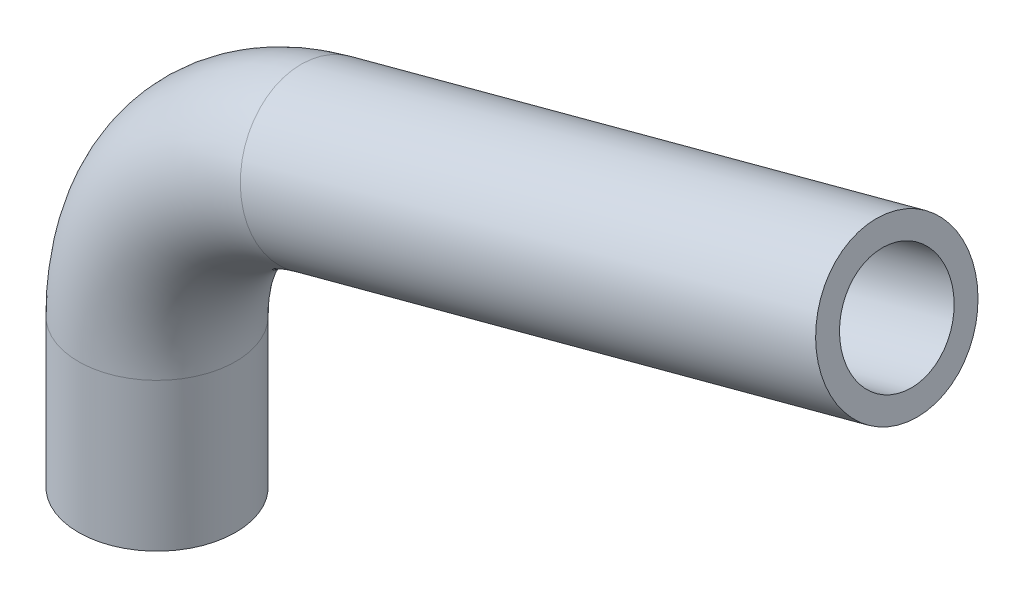
from build123d import *

# Parameters (mm, degrees)
SWEEP1_PROFILE_R     = 13.49375
CUT_SWEEP1_PROFILE_R = 9.525


with BuildPart() as part:
    # Sweep1: sweep along a curve in space
    with BuildLine() as sweep1_path:
        Line((0, 0, 0), (0, 25.4, 0))
        ThreePointArc((0, 25.4, 0), (7.873237735, 48.593810445, 0), (28.238994382, 62.201773982, 0))
        Line((28.238994382, 62.201773982, 0), (127, 88.664705681, 0))
    # Sweep1 profile (on start of the path) → Sweep1 (sweep)
    with BuildSketch(Plane.ZX):
        Circle(SWEEP1_PROFILE_R)
    sweep(path=sweep1_path.line)

    # Cut-Sweep1: sweep along a curve in space
    with BuildLine() as cut_sweep1_path:
        Line((0, 0, 0), (0, 25.4, 0))
        ThreePointArc((0, 25.4, 0), (7.873237735, 48.593810445, 0), (28.238994382, 62.201773982, 0))
        Line((28.238994382, 62.201773982, 0), (127, 88.664705681, 0))
    # Cut-Sweep1 profile (on start of the path) → Cut-Sweep1 (sweep, cut)
    with BuildSketch(Plane.ZX):
        Circle(CUT_SWEEP1_PROFILE_R)
    sweep(path=cut_sweep1_path.line, mode=Mode.SUBTRACT)


solid = part.part
